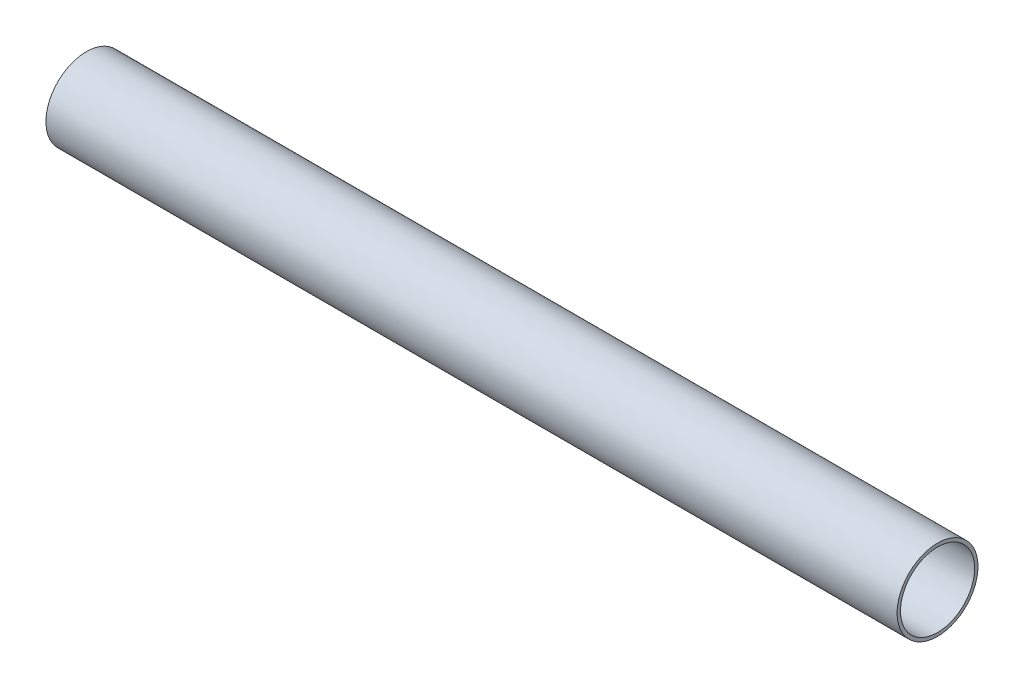
from build123d import *

# Parameters (mm, degrees)
SKETCH1_R           = 19.05
SKETCH1_R_2         = 17.4625
BOSS_EXTRUDE1_DEPTH = 400.939


with BuildPart() as part:
    # Sketch1 → Boss-Extrude1 (new body)
    with BuildSketch(Plane(origin=(0, 0, 0), x_dir=(0, 0, -1), z_dir=(1, 0, 0))):
        Circle(SKETCH1_R)
        Circle(SKETCH1_R_2, mode=Mode.SUBTRACT)
    extrude(amount=BOSS_EXTRUDE1_DEPTH)


solid = part.part
